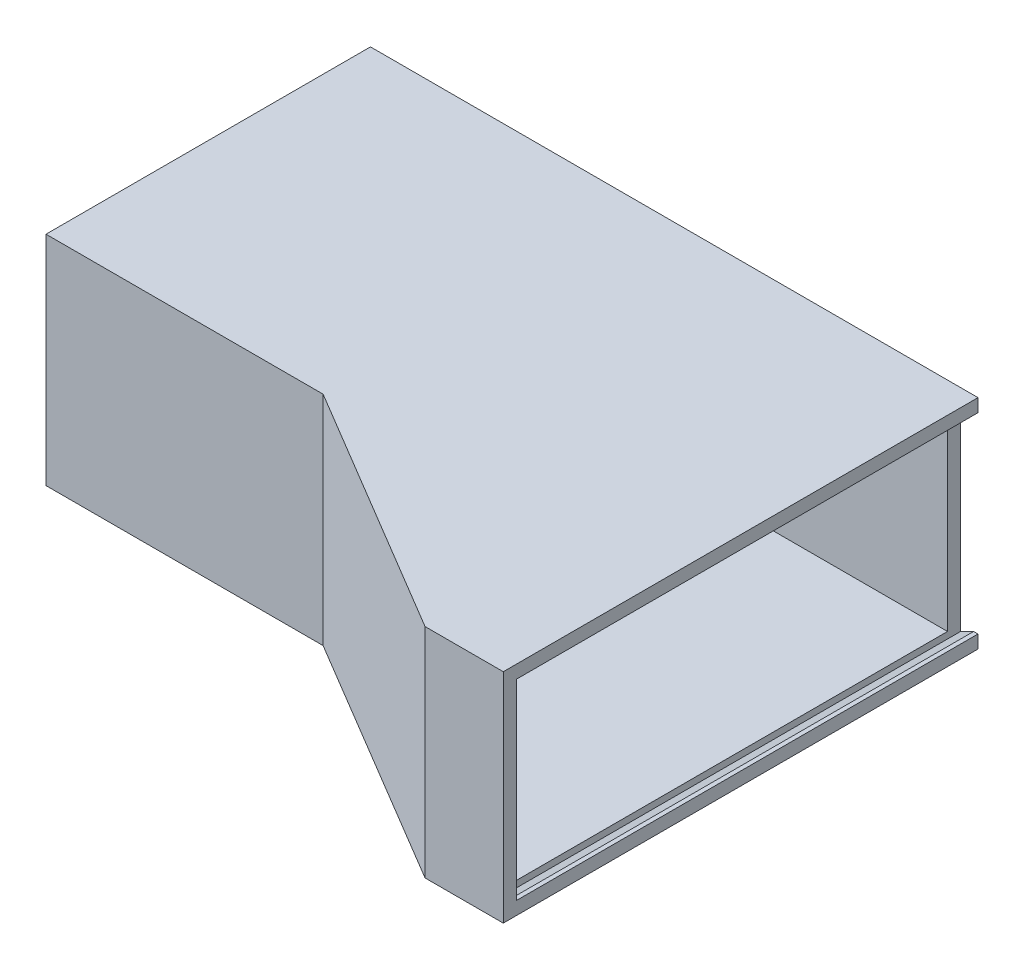
from build123d import *

# Parameters (mm, degrees)
BOSS_EXTRUDE1_DEPTH = 25
BOSS_EXTRUDE2_DEPTH = 3
SKETCH5_W           = 3
SKETCH5_H           = 22
CUT_EXTRUDE1_DEPTH  = 1.5
SKETCH6_W           = 3
SKETCH6_H           = 107.5
CUT_EXTRUDE2_DEPTH  = 1.5
BOSS_EXTRUDE4_DEPTH = 23.5
BOSS_EXTRUDE5_DEPTH = 109


with BuildPart() as part:
    # PCB → Boss-Extrude1 (new body)
    with BuildSketch(Plane(origin=(0, 0, 0), x_dir=(1, 0, 0), z_dir=(0, 1, 0))):
        Polygon((118.862351474, -102.5), (71.5, -74.284131037), (71.5, -68), (-0.5, -68), (-0.5, 0.5), (132, 0.5), (132, 3.5), (-3.5, 3.5), (-3.5, -71), (60.125746031, -71), (68.5, -75.988917258), (118.036460317, -105.5), (135, -105.5), (136, -105.5), (136, -102.5), (132, -102.5), align=None)
    boss_extrude1 = extrude(amount=BOSS_EXTRUDE1_DEPTH)

    # Sketch4 → Boss-Extrude2 (add)
    with BuildSketch(Plane(origin=(0, 25, 0), x_dir=(1, 0, 0), z_dir=(0, 1, 0))):
        Polygon((118.862351474, -102.5), (136, -102.5), (136, 3.5), (132, 3.5), (132, 0.5), (-0.5, 0.5), (-0.5, -68), (71.5, -68), (71.5, -74.284131037), align=None)
    boss_extrude2 = extrude(amount=-BOSS_EXTRUDE2_DEPTH)

    # Sketch5 → Cut-Extrude1 (cut)
    with BuildSketch(Plane(origin=(0, 0, 102.5), x_dir=(-1, 0, 0), z_dir=(0, 0, -1))):
        with Locations((-133.5, 11)):
            Rectangle(SKETCH5_W, SKETCH5_H)
    cut_extrude1 = extrude(amount=-CUT_EXTRUDE1_DEPTH, mode=Mode.SUBTRACT)

    # Sketch6 → Cut-Extrude2 (cut)
    with BuildSketch(Plane.XZ.offset(-22)):
        with Locations((133.5, 50.25)):
            Rectangle(SKETCH6_W, SKETCH6_H)
    cut_extrude2 = extrude(amount=-CUT_EXTRUDE2_DEPTH, mode=Mode.SUBTRACT)

    # Sketch7 → Boss-Extrude4 (add)
    with BuildSketch(Plane.XZ.offset(-23.5)):
        Polygon((135, 102.5), (132, 104), (135, 104), align=None)
    boss_extrude4 = extrude(amount=BOSS_EXTRUDE4_DEPTH)

    # Sketch8 → Boss-Extrude5 (add)
    with BuildSketch(Plane.XY.offset(105.5)):
        Polygon((135, 22), (132, 23.5), (135, 23.5), align=None)
    boss_extrude5 = extrude(amount=-BOSS_EXTRUDE5_DEPTH)

    # Mirror2: Boss-Extrude1, Boss-Extrude2, Cut-Extrude1, Cut-Extrude2, Boss-Extrude4, Boss-Extrude5 across plane
    add(boss_extrude1.mirror(Plane.ZX))
    add(boss_extrude2.mirror(Plane.ZX))
    add(cut_extrude1.mirror(Plane.ZX), mode=Mode.SUBTRACT)
    add(cut_extrude2.mirror(Plane.ZX), mode=Mode.SUBTRACT)
    add(boss_extrude4.mirror(Plane.ZX))
    add(boss_extrude5.mirror(Plane.ZX))


solid = part.part
